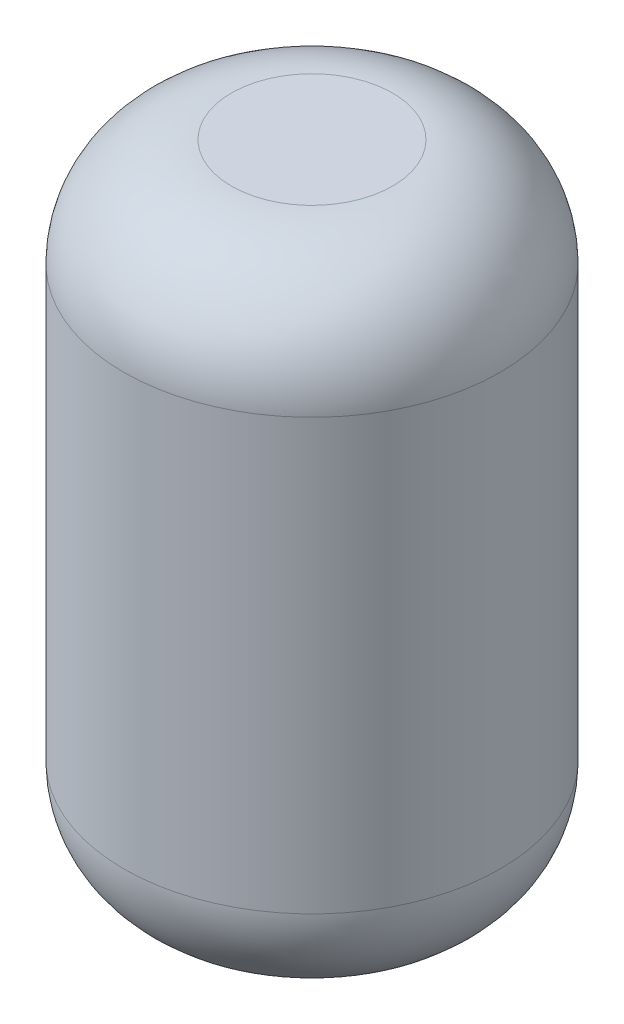
from build123d import *

# Parameters (mm, degrees)
SKETCH1_R           = 44.45
BOSS_EXTRUDE1_DEPTH = 152.4
FILLET1_R           = 25.4


with BuildPart() as part:
    # Sketch1 → Boss-Extrude1 (new body)
    with BuildSketch(Plane(origin=(0, 0, 0), x_dir=(1, 0, 0), z_dir=(0, 1, 0))):
        with Locations(Location((0, 0, 0), (0, 0, 90))):
            Circle(SKETCH1_R)
    extrude(amount=BOSS_EXTRUDE1_DEPTH)

    # Fillet1
    fillet1_edges = [part.edges().sort_by_distance(p)[0] for p in [
        (0, 0, 44.45),
        (0, 152.4, 44.45),
    ]]
    fillet(fillet1_edges, radius=FILLET1_R)


solid = part.part
